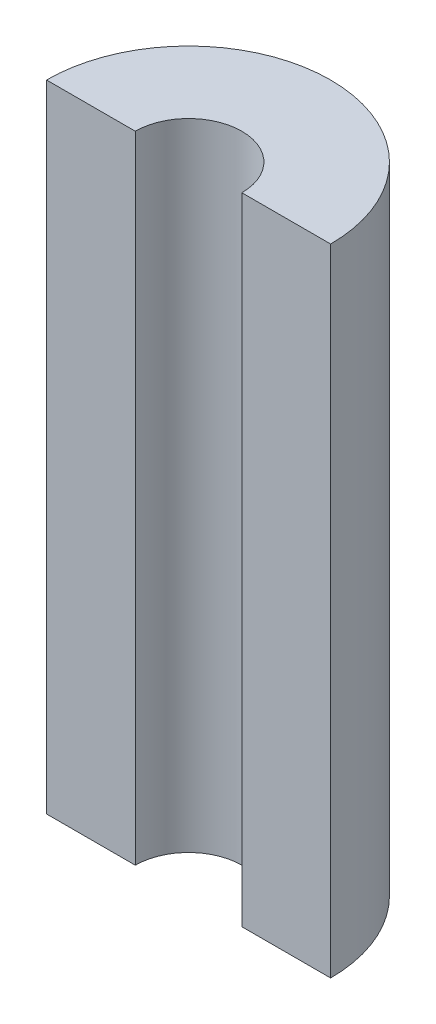
from build123d import *

# Parameters (mm, degrees)
SKETCH1_R           = 80
SKETCH1_R_2         = 30
BOSS_EXTRUDE1_DEPTH = 358


with BuildPart() as part:
    # Sketch1 → Boss-Extrude1 (new body)
    with BuildSketch(Plane(origin=(0, 0, 0), x_dir=(1, 0, 0), z_dir=(0, 1, 0))):
        with Locations(Location((0, 0, 0), (0, 0, 90))):
            Circle(SKETCH1_R)
        with Locations(Location((0, 0, 0), (0, 0, 90))):
            Circle(SKETCH1_R_2, mode=Mode.SUBTRACT)
    extrude(amount=BOSS_EXTRUDE1_DEPTH)

    # Split1
    split(bisect_by=Plane.XY, keep=Keep.BOTTOM)


solid = part.part
